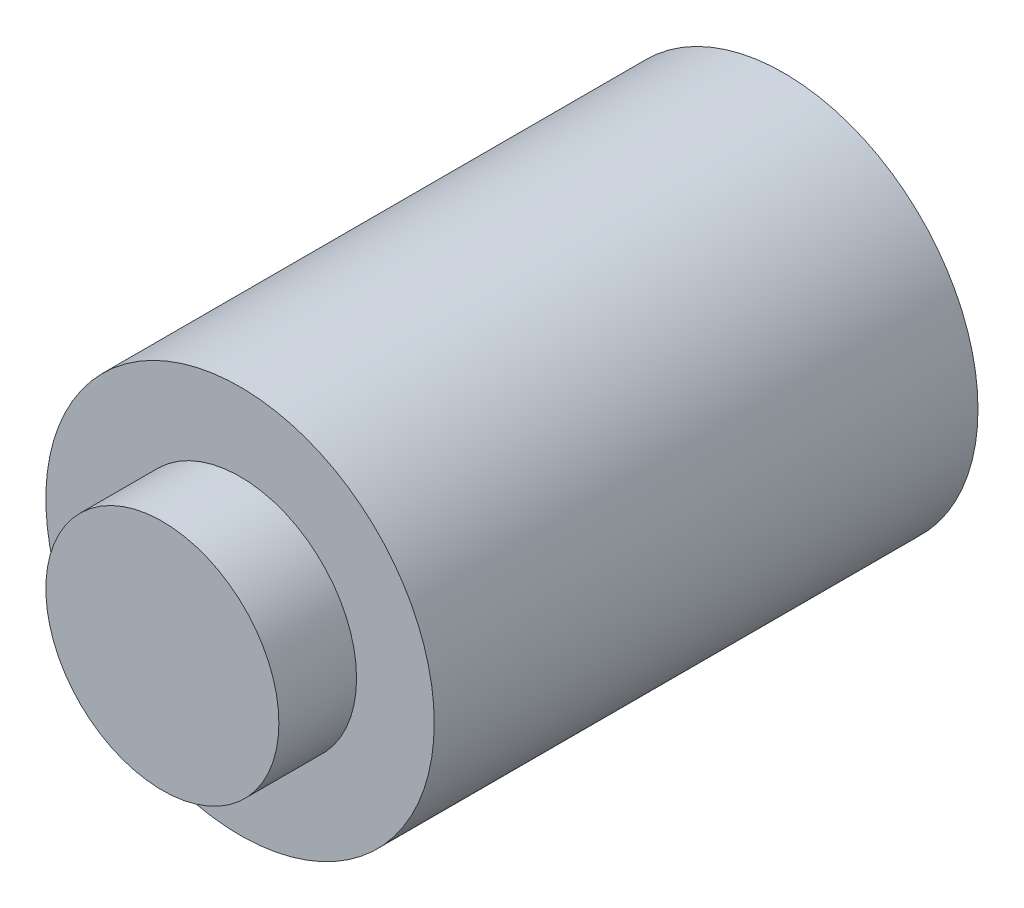
from build123d import *

# Parameters (mm, degrees)
SCHIZZO1_R                      = 5
ESTRUSIONE_ESTRUSIONE1_DEPTH    = 14
SCHIZZO2_R                      = 3
ESTRUSIONE_ESTRUSIONE2_DEPTH    = 2
FORO_FILETTATO_M6_1_D           = 5
FORO_FILETTATO_M6_1_DEPTH       = 6
FORO_FILETTATO_M6_1_CSINK_D     = 7
FORO_FILETTATO_M6_1_CSINK_ANGLE = 90
FORO_FILETTATO_M6_1_TIP         = 1.502151548


with BuildPart() as part:
    # Schizzo1 → Estrusione-Estrusione1 (new body)
    with BuildSketch(Plane.XY):
        Circle(SCHIZZO1_R)
    extrude(amount=ESTRUSIONE_ESTRUSIONE1_DEPTH)

    # Schizzo2 → Estrusione-Estrusione2 (add)
    with BuildSketch(Plane.XY.offset(14)):
        Circle(SCHIZZO2_R)
    extrude(amount=ESTRUSIONE_ESTRUSIONE2_DEPTH)

    # Foro filettato M6-1
    with Locations(Plane(origin=(0, 0, 0), x_dir=(-1, 0, 0), z_dir=(0, 0, -1))):
        with Locations((0, 0)):
            CounterSinkHole(FORO_FILETTATO_M6_1_D / 2, FORO_FILETTATO_M6_1_CSINK_D / 2, depth=FORO_FILETTATO_M6_1_DEPTH, counter_sink_angle=FORO_FILETTATO_M6_1_CSINK_ANGLE)
            with Locations((0, 0, -(FORO_FILETTATO_M6_1_DEPTH + FORO_FILETTATO_M6_1_TIP / 2))):  # 118° drill point
                Cone(0, FORO_FILETTATO_M6_1_D / 2, FORO_FILETTATO_M6_1_TIP, mode=Mode.SUBTRACT)


solid = part.part
